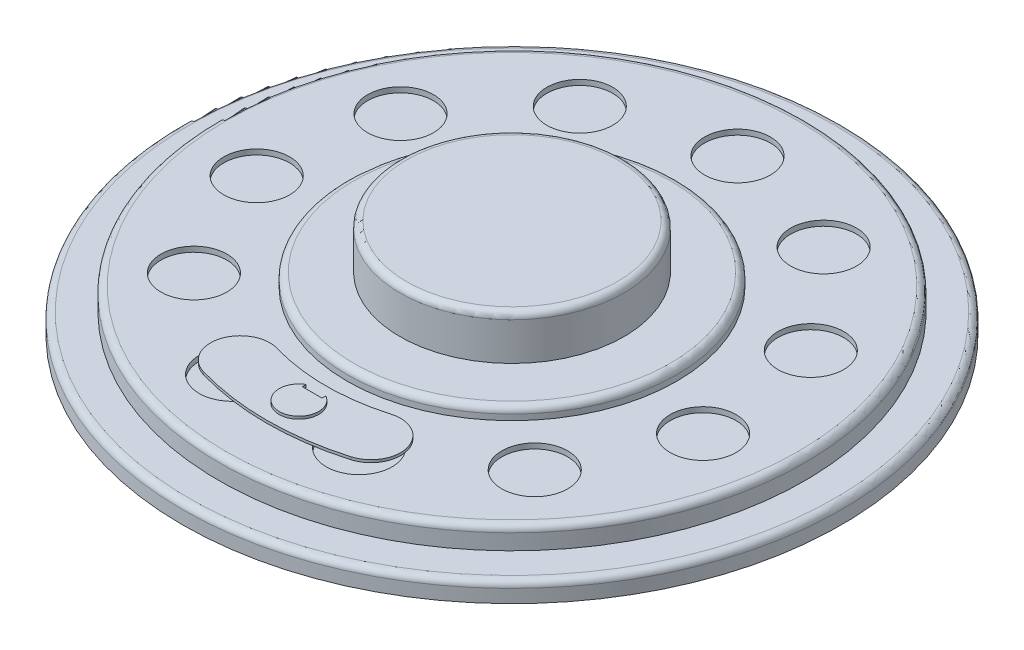
from build123d import *

# Parameters (mm, degrees)
SHELL1_T                = -0.7
SKETCH2_R               = 2.5
CUT_EXTRUDE1_DEPTH      = 38.329664129
SKETCH4_R               = 24.3
SKETCH4_R_2             = 22.8
BOSS_EXTRUDE1_DEPTH     = 0.8
CUT_EXTRUDE2_DEPTH      = 37.869638499
CUT_EXTRUDE2_DEPTH_BACK = 37.869638499
SKETCH8_R               = 1.5
BOSS_EXTRUDE3_START     = 0.2
SKETCH9_R               = 2
SKETCH9_R_2             = 1.5
BOSS_EXTRUDE3_DEPTH     = 0.2
BOSS_EXTRUDE4_DEPTH     = 0.2
BOSS_EXTRUDE5_START     = 0.2
SKETCH11_R              = 1.5
BOSS_EXTRUDE5_DEPTH     = 0.2
SKETCH12_W              = 1.5
SKETCH12_H              = 1.5
CUT_EXTRUDE3_DEPTH      = 0.2


with BuildPart() as part:
    # Sketch1 → Revolve1 (revolve)
    with BuildSketch(Plane.XY):
        with BuildLine():
            Line((25, 0.021288118), (25, 1.020862899))
            ThreePointArc((25, 1.020862899), (24.853553391, 1.37441629), (24.5, 1.520862899))
            Line((24.5, 1.520862899), (22.212745272, 1.520862899))
            Line((22.212745272, 1.520862899), (22.212745272, 2.701794053))
            ThreePointArc((22.212745272, 2.701794053), (22.066298662, 3.055347443), (21.712745272, 3.201794053))
            Line((21.712745272, 3.201794053), (12.5, 3.201794053))
            Line((12.5, 3.201794053), (12.5, 3.631549238))
            ThreePointArc((12.5, 3.631549238), (12.353553391, 3.985102629), (12, 4.131549238))
            Line((12, 4.131549238), (8.5, 4.131549238))
            Line((8.5, 4.131549238), (8.5, 7))
            ThreePointArc((8.5, 7), (8.353553391, 7.353553391), (8, 7.5))
            Line((8, 7.5), (0, 7.5))
            Line((0, 7.5), (0, 0))
            Line((0, 0), (25, 0.021288118))
        make_face()
    revolve(axis=Axis((0, 0, 0), (0, 1, 0)))

    # Shell1
    shell1_openings = [part.faces().sort_by_distance(p)[0] for p in [
        (-12.5, 0.010644059, 0),
    ]]
    offset(amount=SHELL1_T, openings=shell1_openings, kind=Kind.INTERSECTION)

    # Sketch2 → Cut-Extrude1 (cut, through all)
    with BuildSketch(Plane(origin=(0, 12, 0), x_dir=(1, 0, 0), z_dir=(0, 1, 0))):
        with Locations((0, 17.106372636)):
            Circle(SKETCH2_R)
        with Locations((9.248403286, 14.390796414)):
            Circle(SKETCH2_R)
        with Locations((15.560503874, 7.106244011)):
            Circle(SKETCH2_R)
        with Locations((16.932254428, -2.434490655)):
            Circle(SKETCH2_R)
        with Locations((12.928133838, -11.202291739)):
            Circle(SKETCH2_R)
        with Locations((4.819422101, -16.413444348)):
            Circle(SKETCH2_R)
        with Locations((-4.819422101, -16.413444348)):
            Circle(SKETCH2_R)
        with Locations((-12.928133838, -11.202291739)):
            Circle(SKETCH2_R)
        with Locations((-16.932254428, -2.434490655)):
            Circle(SKETCH2_R)
        with Locations((-15.560503874, 7.106244011)):
            Circle(SKETCH2_R)
        with Locations((-9.248403286, 14.390796414)):
            Circle(SKETCH2_R)
    extrude(amount=-CUT_EXTRUDE1_DEPTH, mode=Mode.SUBTRACT)

    # Sketch8 → Cut-Extrude2 (cut, two sides: drawn at the far end of the back side and taken through both)
    with BuildSketch(Plane(origin=(0, 3.201794053, 1.756226728), x_dir=(1, 0, 0), z_dir=(0, 1, 0)).offset(-CUT_EXTRUDE2_DEPTH_BACK)):
        with Locations((0, -14.40726356)):
            Circle(SKETCH8_R)
    extrude(amount=CUT_EXTRUDE2_DEPTH + CUT_EXTRUDE2_DEPTH_BACK, mode=Mode.SUBTRACT)

    # Sketch9 → Boss-Extrude3 (add)
    with BuildSketch(Plane(origin=(0, 3.201794053, 1.756226728), x_dir=(1, 0, 0), z_dir=(0, 1, 0)).offset(BOSS_EXTRUDE3_START)):
        with Locations((0, -14.40726356)):
            Circle(SKETCH9_R)
        with Locations((0, -14.40726356)):
            Circle(SKETCH9_R_2, mode=Mode.SUBTRACT)
    extrude(amount=-BOSS_EXTRUDE3_DEPTH)

    # Sketch10 → Boss-Extrude4 (add)
    with BuildSketch(Plane(origin=(0, 3.401794053, 0), x_dir=(1, 0, 0), z_dir=(0, 1, 0))):
        with BuildLine():
            ThreePointArc((-4.43385306, -13.39435296), (-0.101104891, -14.01223976), (4.231643279, -13.39435296))
            ThreePointArc((4.231643279, -13.39435296), (7.020897348, -14.9257124), (5.489537908, -17.714966469))
            ThreePointArc((5.489537908, -17.714966469), (-0.101104891, -18.51223976), (-5.691747689, -17.714966469))
            ThreePointArc((-5.691747689, -17.714966469), (-7.223107129, -14.9257124), (-4.43385306, -13.39435296))
        make_face()
    extrude(amount=BOSS_EXTRUDE4_DEPTH)

    # Sketch11 → Boss-Extrude5 (add)
    with BuildSketch(Plane(origin=(0, 3.601794053, 0), x_dir=(1, 0, 0), z_dir=(0, 1, 0)).offset(BOSS_EXTRUDE5_START)):
        with Locations((0, -16.163490288)):
            Circle(SKETCH11_R)
    extrude(amount=-BOSS_EXTRUDE5_DEPTH)

    # Sketch12 → Cut-Extrude3 (cut)
    with BuildSketch(Plane(origin=(0, 3.801794053, 0), x_dir=(1, 0, 0), z_dir=(0, 1, 0))):
        with Locations((0, -14.40726356)):
            Rectangle(SKETCH12_W, SKETCH12_H)
    extrude(amount=-CUT_EXTRUDE3_DEPTH, mode=Mode.SUBTRACT)


with BuildPart() as body_2:
    # Sketch4 → Boss-Extrude1 (new body)
    with BuildSketch(Plane.XZ.offset(-0.820862899)):
        Circle(SKETCH4_R)
        Circle(SKETCH4_R_2, mode=Mode.SUBTRACT)
    extrude(amount=BOSS_EXTRUDE1_DEPTH)

    # Sketch18 → Revolve2 (revolve)
    with BuildSketch(Plane.XY):
        with BuildLine():
            Line((8.1, 3.731549238), (8.1, 7))
            ThreePointArc((8.1, 7), (8.070710678, 7.070710678), (8, 7.1))
            Line((8, 7.1), (0.4, 7.1))
            Line((0.4, 7.1), (0.4, 0.400340755))
            Line((0.4, 0.400340755), (24.6, 0.420947653))
            Line((24.6, 0.420947653), (24.6, 1.020862899))
            ThreePointArc((24.6, 1.020862899), (24.570710678, 1.091573577), (24.5, 1.120862899))
            Line((24.5, 1.120862899), (21.812745272, 1.120862899))
            Line((21.812745272, 1.120862899), (21.812745272, 2.701794053))
            ThreePointArc((21.812745272, 2.701794053), (21.78345595, 2.772504731), (21.712745272, 2.801794053))
            Line((21.712745272, 2.801794053), (12.1, 2.801794053))
            Line((12.1, 2.801794053), (12.1, 3.631549238))
            ThreePointArc((12.1, 3.631549238), (12.070710678, 3.702259916), (12, 3.731549238))
            Line((12, 3.731549238), (8.1, 3.731549238))
        make_face()
    revolve(axis=Axis((0, 0, 0), (0, -1, 0)))


solid = Compound([part.part, body_2.part])
